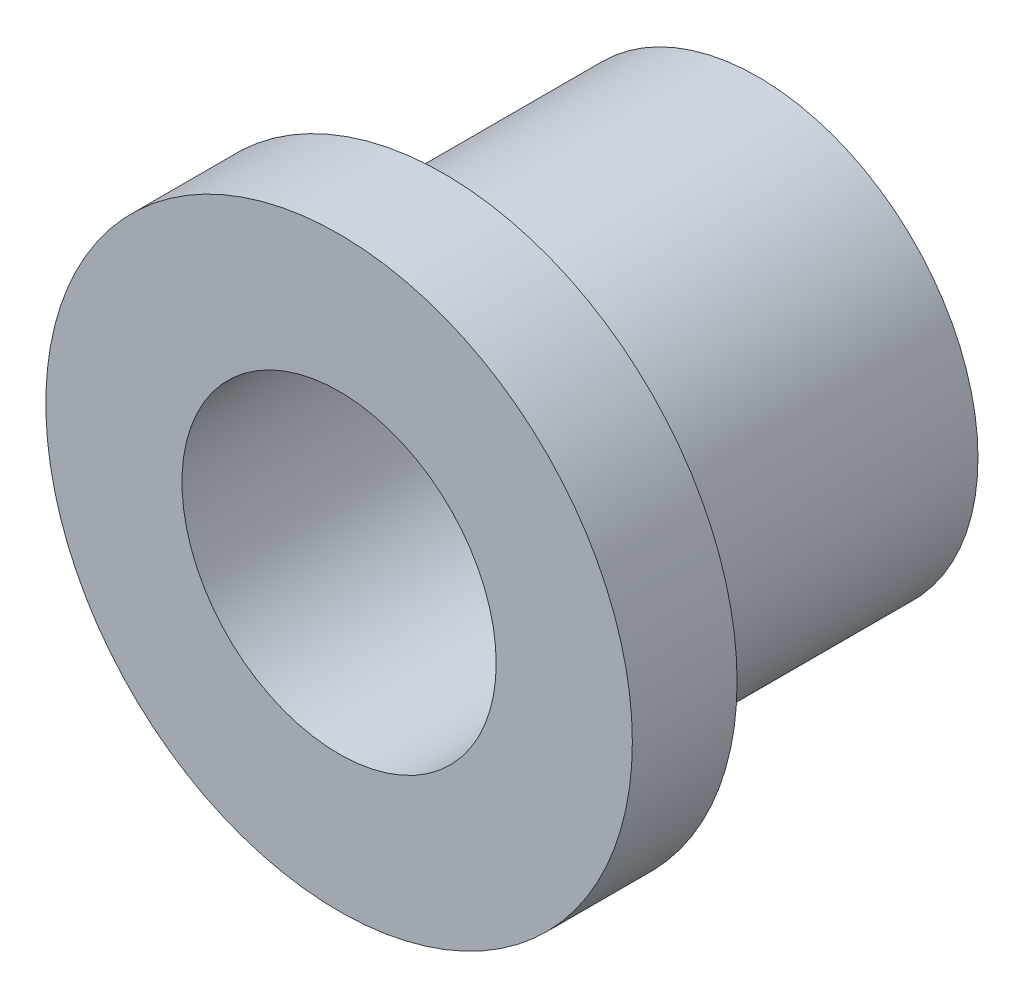
from build123d import *

# Parameters (mm, degrees)
SKETCH1_R           = 10.5
SKETCH1_R_2         = 7.5
BOSS_EXTRUDE1_DEPTH = 15
SKETCH2_R           = 14
SKETCH2_R_2         = 7.5
BOSS_EXTRUDE2_DEPTH = 5


with BuildPart() as part:
    # Sketch1 → Boss-Extrude1 (new body)
    with BuildSketch(Plane.XY):
        Circle(SKETCH1_R)
        Circle(SKETCH1_R_2, mode=Mode.SUBTRACT)
    extrude(amount=BOSS_EXTRUDE1_DEPTH)

    # Sketch2 → Boss-Extrude2 (add)
    with BuildSketch(Plane.XY.offset(15)):
        Circle(SKETCH2_R)
        Circle(SKETCH2_R_2, mode=Mode.SUBTRACT)
    extrude(amount=BOSS_EXTRUDE2_DEPTH)


solid = part.part
